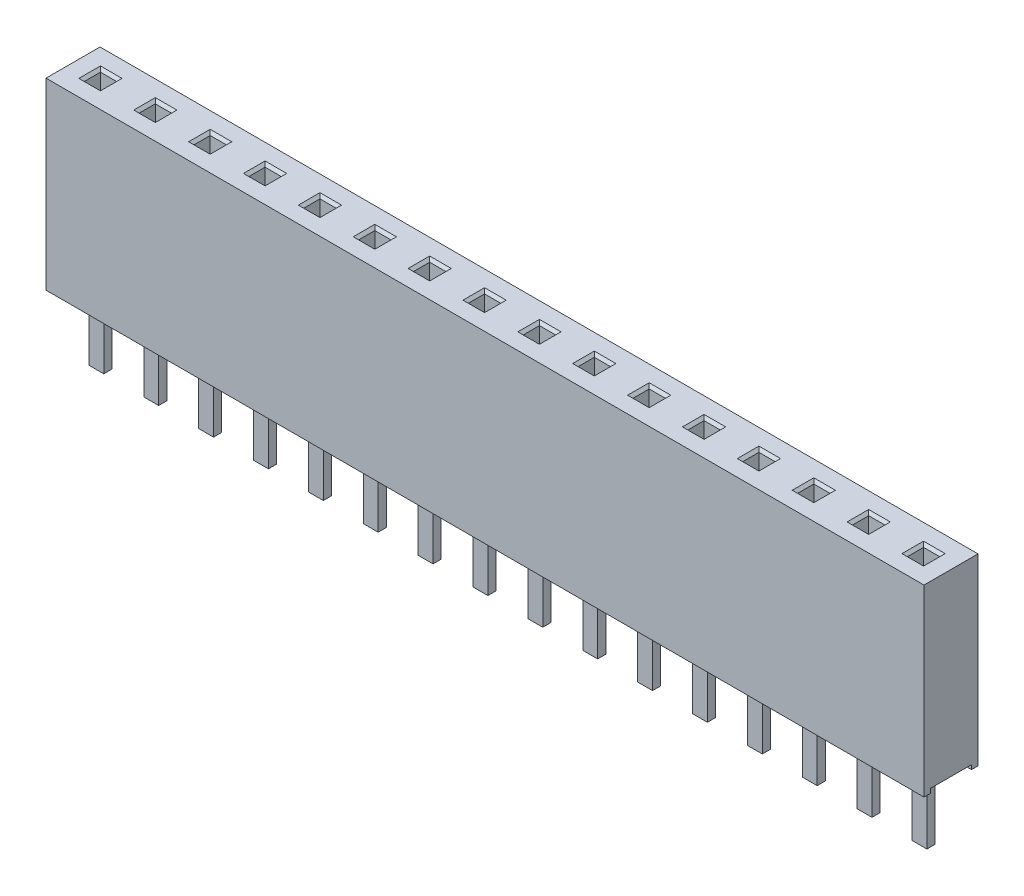
from build123d import *

# Parameters (mm, degrees)
SKETCH1_W                  = 40.64
SKETCH1_H                  = 2.5
BOSS_EXTRUDE1_DEPTH        = 8.5
SKETCH4_W                  = 1.9
SKETCH4_H                  = 0.2
CUT_EXTRUDE2_DEPTH         = 42.538200491
SKETCH2_W                  = 0.69
SKETCH2_H                  = 0.38
BOSS_EXTRUDE2_DEPTH        = 3.4
SKETCH3_W                  = 0.75
SKETCH3_H                  = 0.75
CUT_EXTRUDE1_DEPTH         = 6.05
CHAMFER1_SIZE              = 0.125
CHAMFER2_SIZE              = 0.125
LPATTERN1_COUNT            = 16
LPATTERN1_PITCH            = 2.54
CHAMFER1_OF_LPATTERN1_SIZE = 0.125
CHAMFER2_OF_LPATTERN1_SIZE = 0.125


with BuildPart() as part:
    # Sketch1 → Boss-Extrude1 (new body)
    with BuildSketch(Plane(origin=(0, 0, 0), x_dir=(1, 0, 0), z_dir=(0, 1, 0))):
        with Locations((19.05, 0)):
            Rectangle(SKETCH1_W, SKETCH1_H)
    extrude(amount=BOSS_EXTRUDE1_DEPTH)

    # Sketch4 → Cut-Extrude2 (cut, through all)
    with BuildSketch(Plane.ZY.offset(1.27)):
        with Locations((0, 0.1)):
            Rectangle(SKETCH4_W, SKETCH4_H)
    extrude(amount=-CUT_EXTRUDE2_DEPTH, mode=Mode.SUBTRACT)

    # Sketch2 → Boss-Extrude2 (add)
    with BuildSketch(Plane.XZ.offset(-0.2)):
        Rectangle(SKETCH2_W, SKETCH2_H)
    boss_extrude2 = extrude(amount=BOSS_EXTRUDE2_DEPTH)

    # Sketch3 → Cut-Extrude1 (cut)
    with BuildSketch(Plane(origin=(0, 8.5, 0), x_dir=(1, 0, 0), z_dir=(0, 1, 0))):
        Rectangle(SKETCH3_W, SKETCH3_H)
    cut_extrude1 = extrude(amount=-CUT_EXTRUDE1_DEPTH, mode=Mode.SUBTRACT)

    # Chamfer1
    chamfer1_edges = [part.edges().sort_by_distance(p)[0] for p in [
        (-0.375, 8.5, 0),
        (0, 8.5, 0.375),
        (0.375, 8.5, 0),
        (0, 8.5, -0.375),
    ]]
    chamfer(chamfer1_edges, length=CHAMFER1_SIZE)

    # Chamfer2
    chamfer2_edges = [part.edges().sort_by_distance(p)[0] for p in [
        (0, -3.2, 0.19),
        (0.345, -3.2, 0),
        (-0.345, -3.2, 0),
        (0, -3.2, -0.19),
    ]]
    chamfer(chamfer2_edges, length=CHAMFER2_SIZE)

    # LPattern1: Boss-Extrude2, Cut-Extrude1 ×16
    with Locations(*[(i * LPATTERN1_PITCH, 0, 0) for i in range(1, LPATTERN1_COUNT)]):
        add(boss_extrude2)
        add(cut_extrude1, mode=Mode.SUBTRACT)

    # Chamfer1 of LPattern1
    chamfer1_of_lpattern1_edges = [part.edges().sort_by_distance(p)[0] for p in [
        (2.165, 8.5, 0),
        (2.54, 8.5, 0.375),
        (2.915, 8.5, 0),
        (2.54, 8.5, -0.375),
        (4.705, 8.5, 0),
        (5.08, 8.5, 0.375),
        (5.455, 8.5, 0),
        (5.08, 8.5, -0.375),
        (7.245, 8.5, 0),
        (7.62, 8.5, 0.375),
        (7.995, 8.5, 0),
        (7.62, 8.5, -0.375),
        (9.785, 8.5, 0),
        (10.16, 8.5, 0.375),
        (10.535, 8.5, 0),
        (10.16, 8.5, -0.375),
        (12.325, 8.5, 0),
        (12.7, 8.5, 0.375),
        (13.075, 8.5, 0),
        (12.7, 8.5, -0.375),
        (14.865, 8.5, 0),
        (15.24, 8.5, 0.375),
        (15.615, 8.5, 0),
        (15.24, 8.5, -0.375),
        (17.405, 8.5, 0),
        (17.78, 8.5, 0.375),
        (18.155, 8.5, 0),
        (17.78, 8.5, -0.375),
        (19.945, 8.5, 0),
        (20.32, 8.5, 0.375),
        (20.695, 8.5, 0),
        (20.32, 8.5, -0.375),
        (22.485, 8.5, 0),
        (22.86, 8.5, 0.375),
        (23.235, 8.5, 0),
        (22.86, 8.5, -0.375),
        (25.025, 8.5, 0),
        (25.4, 8.5, 0.375),
        (25.775, 8.5, 0),
        (25.4, 8.5, -0.375),
        (27.565, 8.5, 0),
        (27.94, 8.5, 0.375),
        (28.315, 8.5, 0),
        (27.94, 8.5, -0.375),
        (30.105, 8.5, 0),
        (30.48, 8.5, 0.375),
        (30.855, 8.5, 0),
        (30.48, 8.5, -0.375),
        (32.645, 8.5, 0),
        (33.02, 8.5, 0.375),
        (33.395, 8.5, 0),
        (33.02, 8.5, -0.375),
        (35.185, 8.5, 0),
        (35.56, 8.5, 0.375),
        (35.935, 8.5, 0),
        (35.56, 8.5, -0.375),
        (37.725, 8.5, 0),
        (38.1, 8.5, 0.375),
        (38.475, 8.5, 0),
        (38.1, 8.5, -0.375),
    ]]
    chamfer(chamfer1_of_lpattern1_edges, length=CHAMFER1_OF_LPATTERN1_SIZE)

    # Chamfer2 of LPattern1
    chamfer2_of_lpattern1_edges = [part.edges().sort_by_distance(p)[0] for p in [
        (2.54, -3.2, 0.19),
        (2.885, -3.2, 0),
        (2.195, -3.2, 0),
        (2.54, -3.2, -0.19),
        (5.08, -3.2, 0.19),
        (5.425, -3.2, 0),
        (4.735, -3.2, 0),
        (5.08, -3.2, -0.19),
        (7.62, -3.2, 0.19),
        (7.965, -3.2, 0),
        (7.275, -3.2, 0),
        (7.62, -3.2, -0.19),
        (10.16, -3.2, 0.19),
        (10.505, -3.2, 0),
        (9.815, -3.2, 0),
        (10.16, -3.2, -0.19),
        (12.7, -3.2, 0.19),
        (13.045, -3.2, 0),
        (12.355, -3.2, 0),
        (12.7, -3.2, -0.19),
        (15.24, -3.2, 0.19),
        (15.585, -3.2, 0),
        (14.895, -3.2, 0),
        (15.24, -3.2, -0.19),
        (17.78, -3.2, 0.19),
        (18.125, -3.2, 0),
        (17.435, -3.2, 0),
        (17.78, -3.2, -0.19),
        (20.32, -3.2, 0.19),
        (20.665, -3.2, 0),
        (19.975, -3.2, 0),
        (20.32, -3.2, -0.19),
        (22.86, -3.2, 0.19),
        (23.205, -3.2, 0),
        (22.515, -3.2, 0),
        (22.86, -3.2, -0.19),
        (25.4, -3.2, 0.19),
        (25.745, -3.2, 0),
        (25.055, -3.2, 0),
        (25.4, -3.2, -0.19),
        (27.94, -3.2, 0.19),
        (28.285, -3.2, 0),
        (27.595, -3.2, 0),
        (27.94, -3.2, -0.19),
        (30.48, -3.2, 0.19),
        (30.825, -3.2, 0),
        (30.135, -3.2, 0),
        (30.48, -3.2, -0.19),
        (33.02, -3.2, 0.19),
        (33.365, -3.2, 0),
        (32.675, -3.2, 0),
        (33.02, -3.2, -0.19),
        (35.56, -3.2, 0.19),
        (35.905, -3.2, 0),
        (35.215, -3.2, 0),
        (35.56, -3.2, -0.19),
        (38.1, -3.2, 0.19),
        (38.445, -3.2, 0),
        (37.755, -3.2, 0),
        (38.1, -3.2, -0.19),
    ]]
    chamfer(chamfer2_of_lpattern1_edges, length=CHAMFER2_OF_LPATTERN1_SIZE)


solid = part.part
